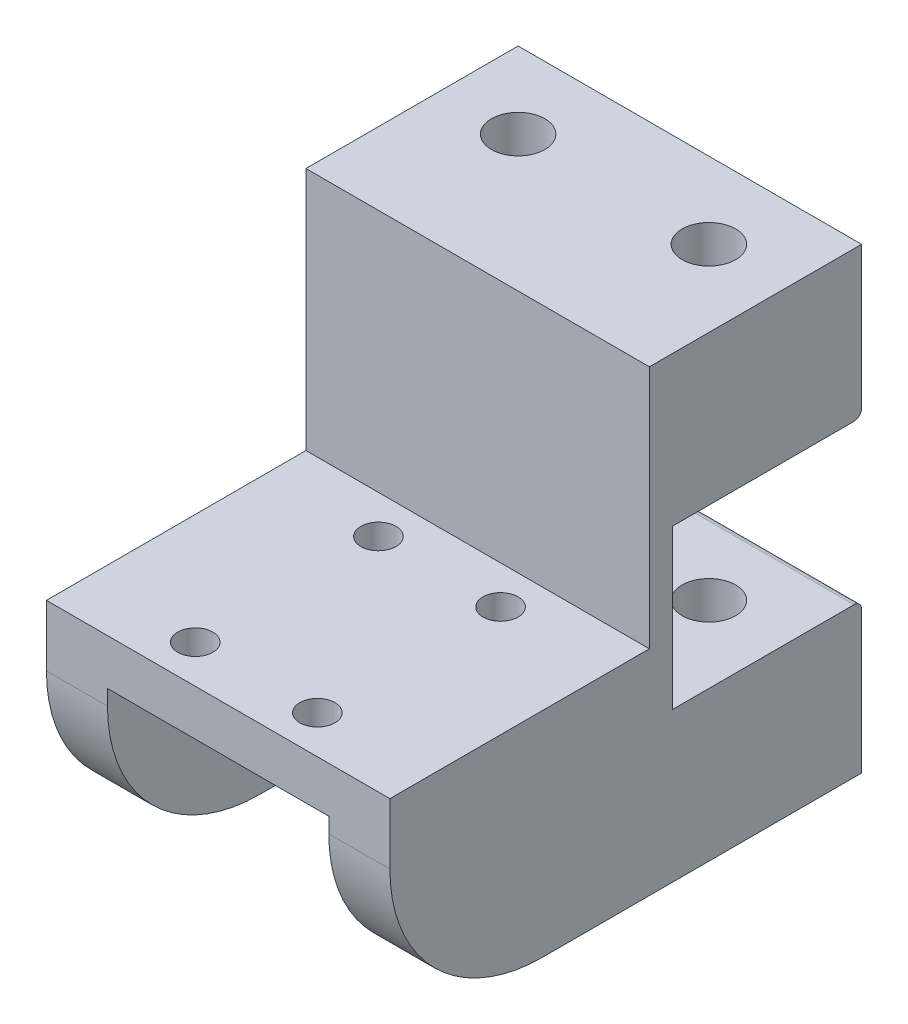
from build123d import *

# Parameters (mm, degrees)
SKETCH_1_W          = 22.5
SKETCH_1_H          = 17
EXTRUDE_1_DEPTH     = 3
HOLE_WIZARD_1_D     = 2.3
SKETCH_5_W          = 22.5
SKETCH_5_H          = 4
SKETCH_5_H_2        = 3
EXTRUDE_2_DEPTH     = 1.5
SKETCH_8_W          = 22.5
SKETCH_8_H          = 10
EXTRUDE_3_DEPTH     = 1.5
SKETCH_9_W          = 17
SKETCH_9_H          = 14
EXTRUDE_4_DEPTH     = 4
SKETCH_10_W         = 17
SKETCH_10_H         = 14
EXTRUDE_5_DEPTH     = 4
SKETCH_11_W         = 22.5
SKETCH_11_H         = 11
EXTRUDE_6_DEPTH     = 1.5
HOLE_WIZARD_3_D     = 3.3
SKETCH_18_W         = 22.5
SKETCH_18_H         = 10
EXTRUDE_7_DEPTH     = 2.4
SKETCH_21_W         = 22.5
SKETCH_21_H         = 3
EXTRUDE_8_DEPTH     = 2.4
SKETCH_22_W         = 22.5
SKETCH_22_H         = 8
EXTRUDE_9_DEPTH     = 2.4
SKETCH_25_W         = 22.5
SKETCH_25_H         = 8
SKETCH_25_H_2       = 3
CUT_EXTRUDE_1_DEPTH = 36.949582751
SKETCH_26_W         = 22.5
SKETCH_26_H         = 10
EXTRUDE_10_DEPTH    = 10
FILLET_1_R          = 10
HOLE_WIZARD_4_D     = 3.5
SKETCH_30_W         = 12.4
SKETCH_30_H         = 0.2
CUT_EXTRUDE_2_DEPTH = 38.000135135
FILLET_3_R          = 0.5


with BuildPart() as part:
    # 草图1 → 凸台-拉伸1 (new body)
    with BuildSketch(Plane(origin=(0, 0, 0), x_dir=(1, 0, 0), z_dir=(0, 1, 0))):
        Rectangle(SKETCH_1_W, SKETCH_1_H)
    extrude(amount=EXTRUDE_1_DEPTH)

    # 孔1 (through all)
    with Locations(Plane(origin=(0, 3, 0), x_dir=(1, 0, 0), z_dir=(0, 1, 0))):
        with Locations((-4, 6), (4, 6), (-4, -6), (4, -6)):
            Hole(HOLE_WIZARD_1_D / 2)

    # 草图5 → 凸台-拉伸2 (add)
    with BuildSketch(Plane(origin=(0, 0, -8.5), x_dir=(-1, 0, 0), z_dir=(0, 0, -1))):
        with Locations((0, -2)):
            Rectangle(SKETCH_5_W, SKETCH_5_H)
        with Locations((0, 1.5)):
            Rectangle(SKETCH_5_W, SKETCH_5_H_2)
        with Locations((0, 4.5)):
            Rectangle(SKETCH_5_W, SKETCH_5_H_2)
    extrude(amount=EXTRUDE_2_DEPTH)

    # 草图8 → 凸台-拉伸3 (add)
    with BuildSketch(Plane(origin=(0, 0, -10), x_dir=(-1, 0, 0), z_dir=(0, 0, -1))):
        with Locations((0, -9)):
            Rectangle(SKETCH_8_W, SKETCH_8_H)
        with Locations((0, 11)):
            Rectangle(SKETCH_8_W, SKETCH_8_H)
    extrude(amount=-EXTRUDE_3_DEPTH)

    # 草图9 → 凸台-拉伸4 (add)
    with BuildSketch(Plane.ZY.offset(11.25)):
        with Locations((0, -7)):
            Rectangle(SKETCH_9_W, SKETCH_9_H)
    extrude(amount=-EXTRUDE_4_DEPTH)

    # 草图10 → 凸台-拉伸5 (add)
    with BuildSketch(Plane(origin=(11.25, 0, 0), x_dir=(0, 0, -1), z_dir=(1, 0, 0))):
        with Locations((0, -7)):
            Rectangle(SKETCH_10_W, SKETCH_10_H)
    extrude(amount=-EXTRUDE_5_DEPTH)

    # 草图11 → 凸台-拉伸6 (add)
    with BuildSketch(Plane(origin=(0, 0, -10), x_dir=(-1, 0, 0), z_dir=(0, 0, -1))):
        with Locations((0, 21.5)):
            Rectangle(SKETCH_11_W, SKETCH_11_H)
    extrude(amount=-EXTRUDE_6_DEPTH)

    # 孔3 (through all)
    with Locations(Plane(origin=(0, 0, -10), x_dir=(-1, 0, 0), z_dir=(0, 0, -1))):
        with Locations((-7.25, 22), (7.25, 22)):
            Hole(HOLE_WIZARD_3_D / 2)

    # 草图18 → 凸台-拉伸7 (add)
    with BuildSketch(Plane(origin=(0, 0, -10), x_dir=(-1, 0, 0), z_dir=(0, 0, -1))):
        with Locations((0, -9)):
            Rectangle(SKETCH_18_W, SKETCH_18_H)
        with Locations((0, 22)):
            Rectangle(SKETCH_18_W, SKETCH_18_H)
    extrude(amount=EXTRUDE_7_DEPTH)

    # 草图21 → 凸台-拉伸8 (add)
    with BuildSketch(Plane(origin=(0, 0, -10), x_dir=(-1, 0, 0), z_dir=(0, 0, -1))):
        with Locations((0, -2.5)):
            Rectangle(SKETCH_21_W, SKETCH_21_H)
    extrude(amount=EXTRUDE_8_DEPTH)

    # 草图22 → 凸台-拉伸9 (add)
    with BuildSketch(Plane(origin=(0, 0, -10), x_dir=(-1, 0, 0), z_dir=(0, 0, -1))):
        with Locations((0, 13)):
            Rectangle(SKETCH_22_W, SKETCH_22_H)
    extrude(amount=EXTRUDE_9_DEPTH)

    # 草图25 → 切除-拉伸1 (cut, through all)
    with BuildSketch(Plane(origin=(0, 0, -12.4), x_dir=(-1, 0, 0), z_dir=(0, 0, -1))):
        with Locations((0, 23)):
            Rectangle(SKETCH_25_W, SKETCH_25_H)
        with Locations((0, -12.5)):
            Rectangle(SKETCH_25_W, SKETCH_25_H_2)
    extrude(amount=-CUT_EXTRUDE_1_DEPTH, mode=Mode.SUBTRACT)

    # 草图26 → 凸台-拉伸10 (add)
    with BuildSketch(Plane(origin=(0, 0, -12.4), x_dir=(-1, 0, 0), z_dir=(0, 0, -1))):
        with Locations((0, 14)):
            Rectangle(SKETCH_26_W, SKETCH_26_H)
        with Locations((0, -6)):
            Rectangle(SKETCH_26_W, SKETCH_26_H)
    extrude(amount=EXTRUDE_10_DEPTH)

    # 圆角1
    fillet_1_edges = [part.edges().sort_by_distance(p)[0] for p in [
        (-9.25, -11, 8.5),
        (9.25, -11, 8.5),
    ]]
    fillet(fillet_1_edges, radius=FILLET_1_R)

    # 孔4 (through all)
    with Locations(Plane(origin=(0, 19, 0), x_dir=(1, 0, 0), z_dir=(0, 1, 0))):
        with Locations((-6.25, 17.4), (6.25, 17.4)):
            Hole(HOLE_WIZARD_4_D / 2)

    # 草图30 → 切除-拉伸2 (cut, through all)
    with BuildSketch(Plane(origin=(11.25, 0, 0), x_dir=(0, 0, -1), z_dir=(1, 0, 0))):
        with Locations((16.2, 9.1)):
            Rectangle(SKETCH_30_W, SKETCH_30_H)
        with Locations((16.2, -1.1)):
            Rectangle(SKETCH_30_W, SKETCH_30_H)
    extrude(amount=-CUT_EXTRUDE_2_DEPTH, mode=Mode.SUBTRACT)

    # 圆角3
    fillet_3_edges = [part.edges().sort_by_distance(p)[0] for p in [
        (0, 9.2, -22.4),
        (0, -1.2, -22.4),
    ]]
    fillet(fillet_3_edges, radius=FILLET_3_R)


solid = part.part
